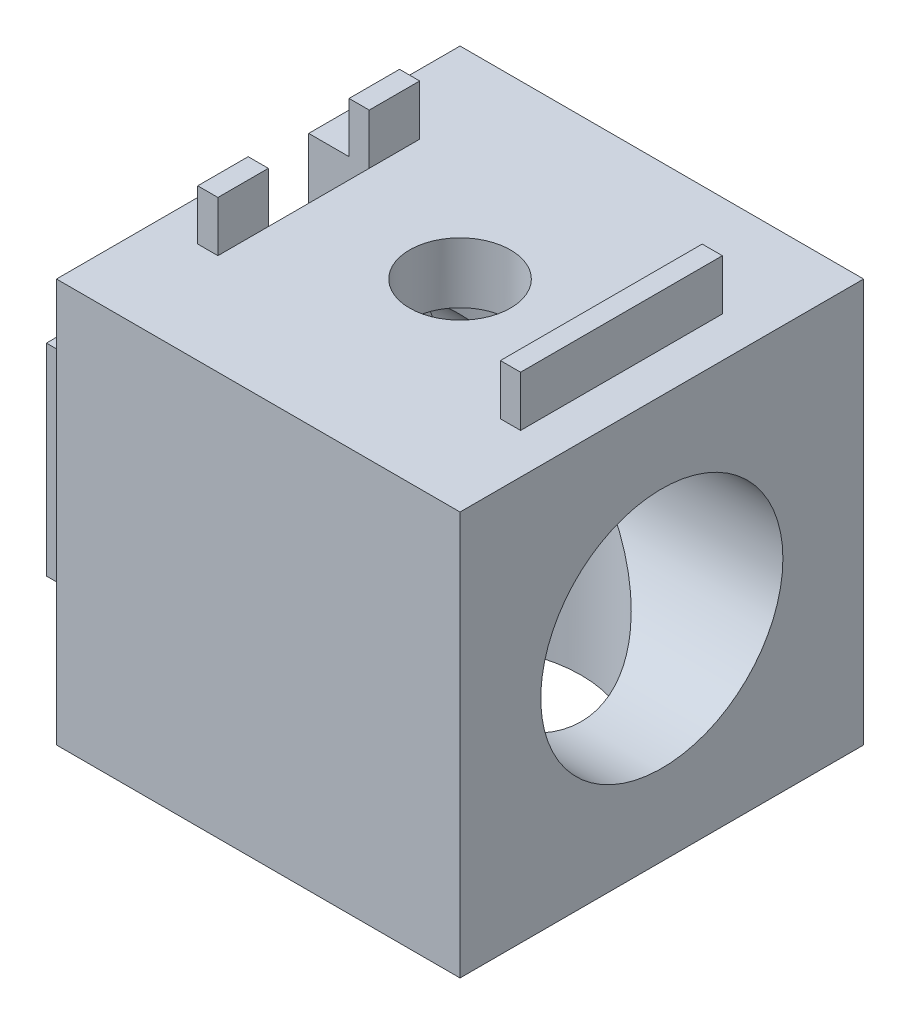
from build123d import *

# Parameters (mm, degrees)
BOSS_EXTRUDE1_DEPTH = 20
SKETCH2_W           = 1
SKETCH2_H           = 2.5
SKETCH2_H_2         = 10
BOSS_EXTRUDE2_DEPTH = 2.5
SKETCH2_3_R         = 2.5
CUT_EXTRUDE1_DEPTH  = 35.641016151
SKETCH3_W           = 1
SKETCH3_H           = 10
BOSS_EXTRUDE3_DEPTH = 2.5
SKETCH5_R           = 6
CUT_EXTRUDE3_DEPTH  = 17
SKETCH7_R           = 6
CUT_EXTRUDE5_DEPTH  = 17


with BuildPart() as part:
    # Sketch1 → Boss-Extrude1 (new body)
    with BuildSketch(Plane(origin=(0, 0, 0), x_dir=(1, 0, 0), z_dir=(0, 1, 0))):
        Polygon((0, 7.5), (3, 7.5), (3, 12.5), (0, 12.5), (0, 20), (20, 20), (20, 0), (0, 0), align=None)
    extrude(amount=BOSS_EXTRUDE1_DEPTH)

    # Sketch2 → Boss-Extrude2 (add)
    with BuildSketch(Plane(origin=(0, 20, 0), x_dir=(1, 0, 0), z_dir=(0, 1, 0))):
        with Locations((2.5, 6.25)):
            Rectangle(SKETCH2_W, SKETCH2_H)
        with Locations((2.5, 13.75)):
            Rectangle(SKETCH2_W, SKETCH2_H)
        with Locations((17.5, 10)):
            Rectangle(SKETCH2_W, SKETCH2_H_2)
    extrude(amount=BOSS_EXTRUDE2_DEPTH)

    # Sketch2<3> → Cut-Extrude1 (cut, through all)
    with BuildSketch(Plane(origin=(0, 20, 0), x_dir=(1, 0, 0), z_dir=(0, 1, 0))):
        with Locations(Location((10, 10, 0), (0, 0, 270))):
            Circle(SKETCH2_3_R)
    extrude(amount=-CUT_EXTRUDE1_DEPTH, mode=Mode.SUBTRACT)

    # Sketch3 → Boss-Extrude3 (add)
    with BuildSketch(Plane.ZY):
        with Locations((-2.5, 10)):
            Rectangle(SKETCH3_W, SKETCH3_H)
        with Locations((-17.5, 10)):
            Rectangle(SKETCH3_W, SKETCH3_H)
    extrude(amount=BOSS_EXTRUDE3_DEPTH)

    # Sketch5 → Cut-Extrude3 (cut)
    with BuildSketch(Plane(origin=(20, 0, 0), x_dir=(0, 0, -1), z_dir=(1, 0, 0))):
        with Locations((10, 10)):
            Circle(SKETCH5_R)
    extrude(amount=-CUT_EXTRUDE3_DEPTH, mode=Mode.SUBTRACT)

    # Sketch7 → Cut-Extrude5 (cut)
    with BuildSketch(Plane.XZ):
        with Locations(Location((10, -10, 0), (0, 0, 270))):
            Circle(SKETCH7_R)
    extrude(amount=-CUT_EXTRUDE5_DEPTH, mode=Mode.SUBTRACT)


solid = part.part
